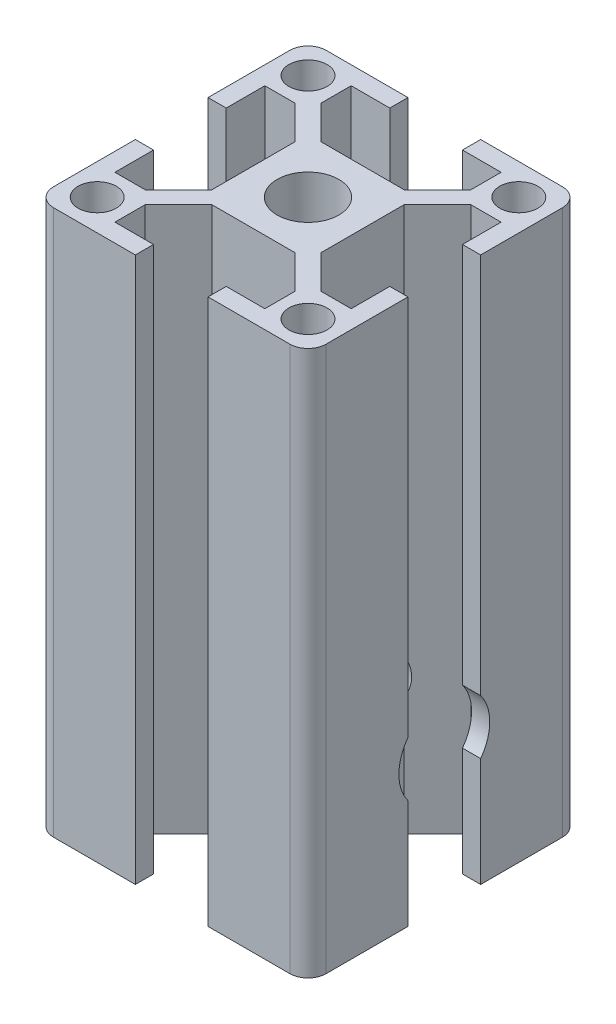
from build123d import *

# Parameters (mm, degrees)
SKETCH1_R               = 2.1
SKETCH1_R_2             = 3.4
PROFILE_LENGTH_DEPTH    = 30
CUT_EXTRUDE1_DEPTH      = 37.742346142
CUT_EXTRUDE1_DEPTH_BACK = 37.742346142
SKETCH2_R               = 5


with BuildPart() as part:
    # Sketch1 → profile length (new, symmetric)
    with BuildSketch(Plane(origin=(0, 0, 0), x_dir=(1, 0, 0), z_dir=(0, 1, 0))):
        with BuildLine():
            Line((-4, 15), (-4, 13))
            Line((-4, 13), (-8.25, 13))
            Line((-8.25, 13), (-8.25, 9.664213562))
            Line((-8.25, 9.664213562), (-4.585786438, 6))
            Line((-4.585786438, 6), (4.585786438, 6))
            Line((4.585786438, 6), (8.25, 9.664213562))
            Line((8.25, 9.664213562), (8.25, 13))
            Line((8.25, 13), (4, 13))
            Line((4, 13), (4, 15))
            Line((4, 15), (13, 15))
            ThreePointArc((13, 15), (14.414213562, 14.414213562), (15, 13))
            Line((15, 13), (15, 4))
            Line((15, 4), (13, 4))
            Line((13, 4), (13, 8.25))
            Line((13, 8.25), (9.664213562, 8.25))
            Line((9.664213562, 8.25), (6, 4.585786438))
            Line((6, 4.585786438), (6, -4.585786438))
            Line((6, -4.585786438), (9.664213562, -8.25))
            Line((9.664213562, -8.25), (13, -8.25))
            Line((13, -8.25), (13, -4))
            Line((13, -4), (15, -4))
            Line((15, -4), (15, -13))
            ThreePointArc((15, -13), (14.414213562, -14.414213562), (13, -15))
            Line((13, -15), (4, -15))
            Line((4, -15), (4, -13))
            Line((4, -13), (8.25, -13))
            Line((8.25, -13), (8.25, -9.664213562))
            Line((8.25, -9.664213562), (4.585786438, -6))
            Line((4.585786438, -6), (-4.585786438, -6))
            Line((-4.585786438, -6), (-8.25, -9.664213562))
            Line((-8.25, -9.664213562), (-8.25, -13))
            Line((-8.25, -13), (-4, -13))
            Line((-4, -13), (-4, -15))
            Line((-4, -15), (-13, -15))
            ThreePointArc((-13, -15), (-14.414213562, -14.414213562), (-15, -13))
            Line((-15, -13), (-15, -4))
            Line((-15, -4), (-13, -4))
            Line((-13, -4), (-13, -8.25))
            Line((-13, -8.25), (-9.664213562, -8.25))
            Line((-9.664213562, -8.25), (-6, -4.585786438))
            Line((-6, -4.585786438), (-6, 4.585786438))
            Line((-6, 4.585786438), (-9.664213562, 8.25))
            Line((-9.664213562, 8.25), (-13, 8.25))
            Line((-13, 8.25), (-13, 4))
            Line((-13, 4), (-15, 4))
            Line((-15, 4), (-15, 13))
            ThreePointArc((-15, 13), (-14.414213562, 14.414213562), (-13, 15))
            Line((-13, 15), (-4, 15))
        make_face()
        with Locations(Location((-11.6, 11.6, 0), (0, 0, 270))):
            Circle(SKETCH1_R, mode=Mode.SUBTRACT)
        with Locations(Location((11.6, 11.6, 0), (0, 0, 90))):
            Circle(SKETCH1_R, mode=Mode.SUBTRACT)
        with Locations(Location((11.6, -11.6, 0), (0, 0, 270))):
            Circle(SKETCH1_R, mode=Mode.SUBTRACT)
        with Locations(Location((-11.6, -11.6, 0), (0, 0, 90))):
            Circle(SKETCH1_R, mode=Mode.SUBTRACT)
        with Locations(Location((0, 0, 0), (0, 0, 270))):
            Circle(SKETCH1_R_2, mode=Mode.SUBTRACT)
    extrude(amount=PROFILE_LENGTH_DEPTH, both=True)

    # Sketch2 → Cut-Extrude1 (cut, two sides: drawn at the far end of the back side and taken through both)
    with BuildSketch(Plane(origin=(0, 0, 0), x_dir=(0, 0, -1), z_dir=(1, 0, 0)).offset(-CUT_EXTRUDE1_DEPTH_BACK)):
        with Locations(Location((0, -15, 0), (0, 0, 23.486027641))):
            Circle(SKETCH2_R)
    extrude(amount=CUT_EXTRUDE1_DEPTH + CUT_EXTRUDE1_DEPTH_BACK, mode=Mode.SUBTRACT)


solid = part.part
